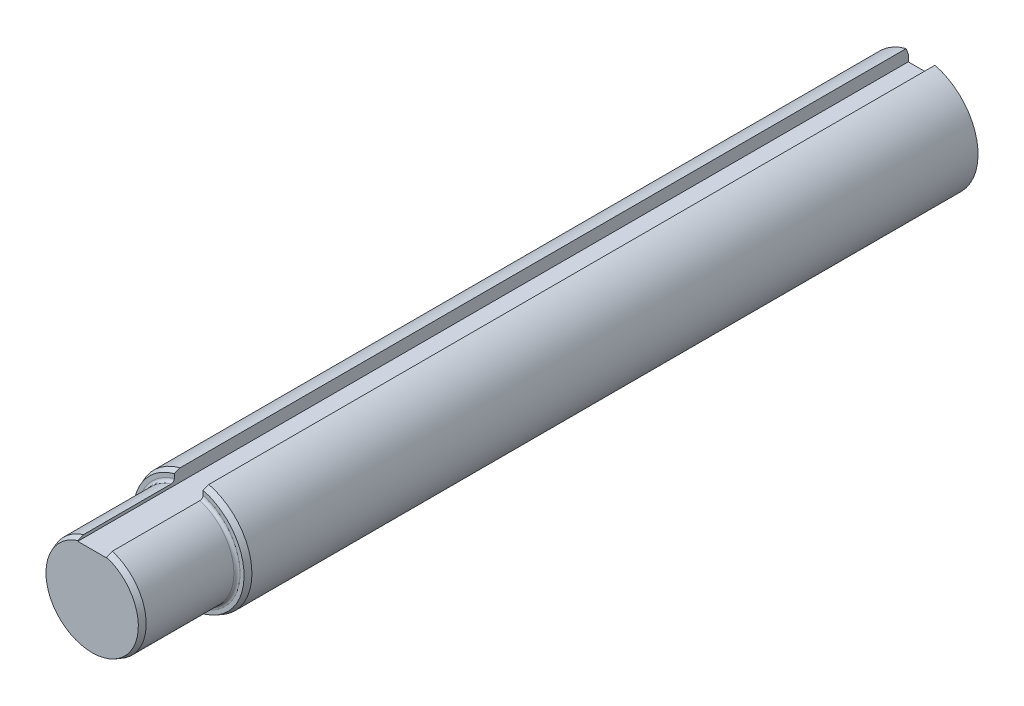
from build123d import *
from OCP.BRepFilletAPI import BRepFilletAPI_MakeChamfer

# Parameters (mm, degrees)
BOSS_EXTRUDE1_DEPTH      = 27.750000126
BOSS_EXTRUDE1_DEPTH_BACK = 41.075600094
SKETCH5_R                = 4.7625
SKETCH5_R_2              = 4
CUT_EXTRUDE1_DEPTH       = 8
CHAMFER1_SIZE            = 0.47625
CHAMFER1_SIZE2           = 0.173340824
FILLET1_R                = 0.254


with BuildPart() as part:
    # Sketch3 → Boss-Extrude1 (new, two sides: drawn at the far end of the back side and taken through both)
    with BuildSketch(Plane.XY.offset(-BOSS_EXTRUDE1_DEPTH_BACK)):
        with BuildLine():
            Line((-1.1938, 3.571875), (-1.1938, 4.610449849))
            ThreePointArc((-1.1938, 4.610449849), (-2.915127249, -3.766090728), (4.7625, 0))
            ThreePointArc((4.7625, 0), (3.766090728, 2.915127249), (1.1938, 4.610449849))
            Line((1.1938, 4.610449849), (1.1938, 3.571875))
            Line((1.1938, 3.571875), (-1.1938, 3.571875))
        make_face()
    extrude(amount=BOSS_EXTRUDE1_DEPTH + BOSS_EXTRUDE1_DEPTH_BACK)

    # Sketch5 → Cut-Extrude1 (cut)
    with BuildSketch(Plane.XY.offset(27.750000126)):
        Circle(SKETCH5_R)
        Circle(SKETCH5_R_2, mode=Mode.SUBTRACT)
    extrude(amount=-CUT_EXTRUDE1_DEPTH, mode=Mode.SUBTRACT)

    # Chamfer1: one chamfer whose edges measure the first distance from different faces: ONE call of the kernel's chamfer builder (chamfer() names one face for all edges)
    chamfer1_edges_1 = [part.edges().sort_by_distance(p)[0] for p in [
        (0, -4, 27.750000126),
    ]]
    chamfer1_side_1 = [part.faces().sort_by_distance(p)[0] for p in [
        (0, -4, 23.750000126),
    ]]
    chamfer1_edges_2 = [part.edges().sort_by_distance(p)[0] for p in [
        (-2.915127249, -3.766090728, 19.750000126),
    ]]
    chamfer1_side_2 = [part.faces().sort_by_distance(p)[0] for p in [
        (-2.915127249, -3.766090728, -10.662799984),
    ]]
    chamfer1_edges_3 = [part.edges().sort_by_distance(p)[0] for p in [
        (-2.915127249, -3.766090728, -41.075600094),
    ]]
    chamfer1_side_3 = [part.faces().sort_by_distance(p)[0] for p in [
        (0, -0.164578508, -41.075600094),
    ]]
    chamfer1 = BRepFilletAPI_MakeChamfer(part.part.solid().wrapped)
    for e in chamfer1_edges_1:
        chamfer1.Add(CHAMFER1_SIZE, CHAMFER1_SIZE2, e.wrapped, chamfer1_side_1[0].wrapped)  # the first distance lies on this face
    for e in chamfer1_edges_2:
        chamfer1.Add(CHAMFER1_SIZE, CHAMFER1_SIZE2, e.wrapped, chamfer1_side_2[0].wrapped)  # the first distance lies on this face
    for e in chamfer1_edges_3:
        chamfer1.Add(CHAMFER1_SIZE, CHAMFER1_SIZE2, e.wrapped, chamfer1_side_3[0].wrapped)  # the first distance lies on this face
    add(Compound.cast(chamfer1.Shape()), mode=Mode.REPLACE)

    # Fillet1
    fillet1_edges = [part.edges().sort_by_distance(p)[0] for p in [
        (0, -4, 19.750000126),
    ]]
    fillet(fillet1_edges, radius=FILLET1_R)


solid = part.part
